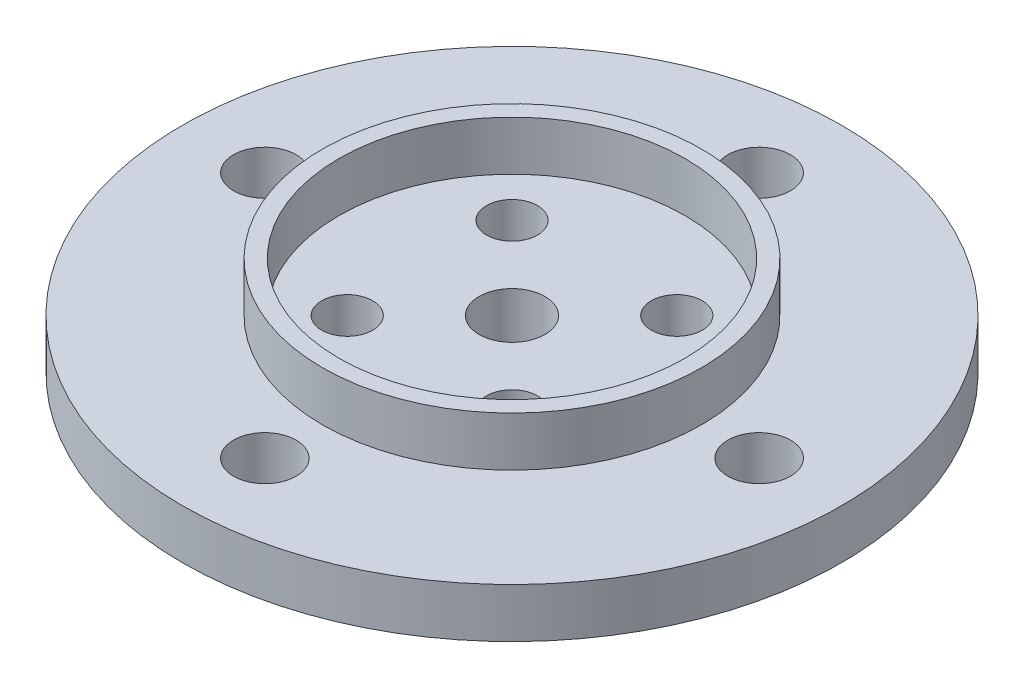
from build123d import *

# Parameters (mm, degrees)
SKETCH_1_R          = 20
SKETCH_1_R_2        = 1.6
SKETCH_1_R_3        = 1.55
SKETCH_1_R_4        = 2
EXTRUDE_1_DEPTH     = 3
SKETCH_2_R          = 11.5
SKETCH_2_R_2        = 10.5
EXTRUDE_2_DEPTH     = 3
SKETCH_3_R          = 1.9
CUT_EXTRUDE_1_DEPTH = 3


with BuildPart() as part:
    # 草图1 → 凸台-拉伸1 (new body)
    with BuildSketch(Plane(origin=(0, 0, 0), x_dir=(1, 0, 0), z_dir=(0, 1, 0))):
        with Locations(Location((0, 0, 0), (0, 0, 270))):
            Circle(SKETCH_1_R)
        with Locations(Location((0, 15, 0), (0, 0, 270))):
            Circle(SKETCH_1_R_2, mode=Mode.SUBTRACT)
        with Locations(Location((15, 0, 0), (0, 0, 270))):
            Circle(SKETCH_1_R_2, mode=Mode.SUBTRACT)
        with Locations(Location((0, -15, 0), (0, 0, 270))):
            Circle(SKETCH_1_R_2, mode=Mode.SUBTRACT)
        with Locations(Location((-15, 0, 0), (0, 0, 270))):
            Circle(SKETCH_1_R_2, mode=Mode.SUBTRACT)
        with Locations(Location((-5, 5, 0), (0, 0, 270))):
            Circle(SKETCH_1_R_3, mode=Mode.SUBTRACT)
        with Locations(Location((5, 5, 0), (0, 0, 270))):
            Circle(SKETCH_1_R_3, mode=Mode.SUBTRACT)
        with Locations(Location((5, -5, 0), (0, 0, 270))):
            Circle(SKETCH_1_R_3, mode=Mode.SUBTRACT)
        with Locations(Location((-5, -5, 0), (0, 0, 270))):
            Circle(SKETCH_1_R_3, mode=Mode.SUBTRACT)
        with Locations(Location((0, 0, 0), (0, 0, 270))):
            Circle(SKETCH_1_R_4, mode=Mode.SUBTRACT)
    extrude(amount=EXTRUDE_1_DEPTH)

    # 草图2 → 凸台-拉伸2 (add)
    with BuildSketch(Plane(origin=(0, 3, 0), x_dir=(1, 0, 0), z_dir=(0, 1, 0))):
        with Locations(Location((0, 0, 0), (0, 0, 270))):
            Circle(SKETCH_2_R)
        with Locations(Location((0, 0, 0), (0, 0, 270))):
            Circle(SKETCH_2_R_2, mode=Mode.SUBTRACT)
    extrude(amount=EXTRUDE_2_DEPTH)

    # 草图3 → 切除-拉伸1 (cut)
    with BuildSketch(Plane.XZ):
        with Locations(Location((0, 15, 0), (0, 0, 270))):
            Circle(SKETCH_3_R)
        with Locations(Location((15, 0, 0), (0, 0, 270))):
            Circle(SKETCH_3_R)
        with Locations(Location((0, -15, 0), (0, 0, 270))):
            Circle(SKETCH_3_R)
        with Locations(Location((-15, 0, 0), (0, 0, 270))):
            Circle(SKETCH_3_R)
    extrude(amount=-CUT_EXTRUDE_1_DEPTH, mode=Mode.SUBTRACT)


solid = part.part
